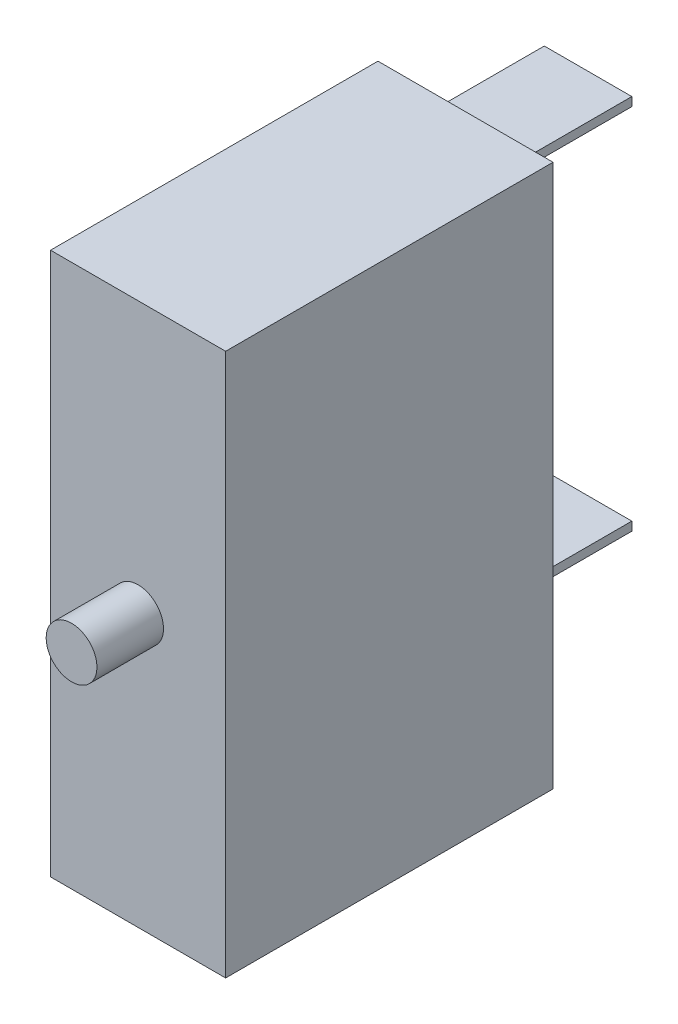
from build123d import *

# Parameters (mm, degrees)
SKETCH1_W                      = 18.7
SKETCH1_H                      = 46
BOSS_EXTRUDE1_DEPTH            = 10
SKETCH2_W                      = 18
SKETCH2_H                      = 7.5
CUT_EXTRUDE1_DEPTH             = 31.870698081
SKETCH3_W                      = 18
SKETCH3_H                      = 7.5
CUT_EXTRUDE2_DEPTH             = 31.870698081
SKETCH4_W                      = 5
SKETCH4_H                      = 0.5
BOSS_EXTRUDE2_DEPTH            = 7
SKETCH5_W                      = 5
SKETCH5_H                      = 0.5
BOSS_EXTRUDE3_DEPTH            = 7
SKETCH6_W                      = 1.45
SKETCH6_H                      = 3.8
F_2_5_2_5_DIAMETER_HOLE1_D     = 2.5
F_2_5_2_5_DIAMETER_HOLE1_DEPTH = 25.7
FILLET1_R                      = 0.5
CUT_EXTRUDE3_DEPTH             = 35.336569427
CUT_EXTRUDE3_DEPTH_BACK        = 35.336569427


with BuildPart() as part:
    # Sketch1 → Boss-Extrude1 (new body)
    with BuildSketch(Plane(origin=(5, 0, 0), x_dir=(0, 0, -1), z_dir=(1, 0, 0))):
        with Locations((8.65, 0)):
            Rectangle(SKETCH1_W, SKETCH1_H)
    extrude(amount=-BOSS_EXTRUDE1_DEPTH)

    # Sketch2 → Cut-Extrude1 (cut, through all)
    with BuildSketch(Plane.ZY.offset(5)):
        with Locations((-9, -19.25)):
            Rectangle(SKETCH2_W, SKETCH2_H)
    extrude(amount=-CUT_EXTRUDE1_DEPTH, mode=Mode.SUBTRACT)

    # Sketch3 → Cut-Extrude2 (cut, through all)
    with BuildSketch(Plane.ZY.offset(5)):
        with Locations((-9, 19.25)):
            Rectangle(SKETCH3_W, SKETCH3_H)
    extrude(amount=-CUT_EXTRUDE2_DEPTH, mode=Mode.SUBTRACT)

    # Sketch4 → Boss-Extrude2 (add)
    with BuildSketch(Plane(origin=(0, 0, -18), x_dir=(-1, 0, 0), z_dir=(0, 0, -1))):
        with Locations((0, -7.25)):
            Rectangle(SKETCH4_W, SKETCH4_H)
    extrude(amount=BOSS_EXTRUDE2_DEPTH)

    # Sketch5 → Boss-Extrude3 (add)
    with BuildSketch(Plane(origin=(0, 0, -18), x_dir=(-1, 0, 0), z_dir=(0, 0, -1))):
        with Locations((0, 13.75)):
            Rectangle(SKETCH5_W, SKETCH5_H)
    extrude(amount=BOSS_EXTRUDE3_DEPTH)

    # Sketch6 → Revolve1 (revolve)
    with BuildSketch(Plane.XZ, mode=Mode.PRIVATE) as revolve1_sk:
        with Locations((0.725, 2.6)):
            Rectangle(SKETCH6_W, SKETCH6_H)
    revolve(revolve1_sk.sketch.rotate(Axis((0, 0, 4.5), (0, 0, -1)), 180), axis=Axis((0, 0, 4.5), (0, 0, -1)))

    # Ø2.5 (2.5) Diameter Hole1
    with Locations(Plane.XY.offset(0.7)):
        with Locations((0, -21), (0, 21)):
            Hole(F_2_5_2_5_DIAMETER_HOLE1_D / 2, depth=F_2_5_2_5_DIAMETER_HOLE1_DEPTH)

    # Fillet1
    fillet1_edges = [part.edges().sort_by_distance(p)[0] for p in [
        (5, 23, 0.35),
        (-5, 23, 0.35),
        (-5, -23, 0.35),
        (5, -23, 0.35),
    ]]
    fillet(fillet1_edges, radius=FILLET1_R)

    # Sketch9 → Cut-Extrude3 (cut, two sides: drawn at the far end of the back side and taken through both)
    with BuildSketch(Plane(origin=(0, 0, 0), x_dir=(-1, 0, 0), z_dir=(0, 0, -1)).offset(-CUT_EXTRUDE3_DEPTH_BACK)):
        with BuildLine():
            Line((4.5, 23), (-4.5, 23))
            ThreePointArc((-4.5, 23), (-4.853553391, 22.853553391), (-5, 22.5))
            Line((-5, 22.5), (-5, 15.5))
            Line((-5, 15.5), (5, 15.5))
            Line((5, 15.5), (5, 22.5))
            ThreePointArc((5, 22.5), (4.853553391, 22.853553391), (4.5, 23))
        make_face()
        with BuildLine():
            Line((-4.5, -23), (4.5, -23))
            ThreePointArc((4.5, -23), (4.853553391, -22.853553391), (5, -22.5))
            Line((5, -22.5), (5, -15.5))
            Line((5, -15.5), (-5, -15.5))
            Line((-5, -15.5), (-5, -22.5))
            ThreePointArc((-5, -22.5), (-4.853553391, -22.853553391), (-4.5, -23))
        make_face()
    extrude(amount=CUT_EXTRUDE3_DEPTH + CUT_EXTRUDE3_DEPTH_BACK, mode=Mode.SUBTRACT)


solid = part.part
